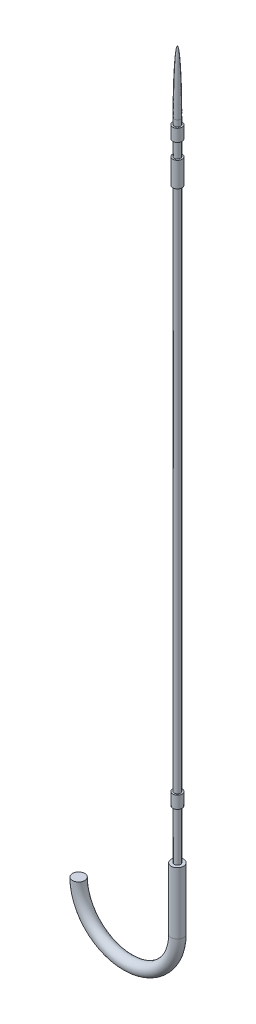
from build123d import *

# Parameters (mm, degrees)
CROQUIS3_R                   = 5
SALIENTE_EXTRUIR1_DEPTH      = 870
CROQUIS5_R                   = 7.5
SALIENTE_EXTRUIR2_DEPTH      = 20
SALIENTE_EXTRUIR3_START      = 80
CROQUIS6_R                   = 5
SALIENTE_EXTRUIR3_DEPTH      = 80
CROQUIS8_R                   = 10
SALIENTE_EXTRUIR4_DEPTH      = 20
SALIENTE_EXTRUIR4_DEPTH_BACK = 20
CROQUIS9_R                   = 7.5
CROQUIS10_R                  = 5
SALIENTE_EXTRUIR5_DEPTH      = 25
SALIENTE_EXTRUIR6_START      = 20
CROQUIS11_R                  = 7.5
SALIENTE_EXTRUIR6_DEPTH      = 20
CROQUIS12_R                  = 5
SALIENTE_EXTRUIR7_DEPTH      = 10
C_PULA2_FACE_RADIUS          = 5
C_PULA2_HEIGHT               = 100


with BuildPart() as part:
    # Croquis3 → Saliente-Extruir1 (new body)
    with BuildSketch(Plane(origin=(0, 0, 0), x_dir=(1, 0, 0), z_dir=(0, 1, 0))):
        Circle(CROQUIS3_R)
    extrude(amount=SALIENTE_EXTRUIR1_DEPTH)

    # Croquis5 → Saliente-Extruir2 (add)
    with BuildSketch(Plane.XZ):
        Circle(CROQUIS5_R)
    extrude(amount=SALIENTE_EXTRUIR2_DEPTH)

    # Croquis6 → Saliente-Extruir3 (add)
    with BuildSketch(Plane.XZ.offset(20).offset(SALIENTE_EXTRUIR3_START)):
        Circle(CROQUIS6_R)
    extrude(amount=-SALIENTE_EXTRUIR3_DEPTH)

    # Barrer1: sweep along a path in Croquis7
    with BuildLine(Plane.XY) as barrer1_path:
        Line((0, -100), (0, -200))
        ThreePointArc((0, -200), (-80, -280), (-160, -200))
    # Croquis8 → Barrer1 (sweep)
    with BuildSketch(Plane.XZ.offset(100)):
        Circle(CROQUIS8_R)
    sweep(path=barrer1_path.line)

    # Croquis9 → Saliente-Extruir4 (add, two sides: drawn at the far end of the back side and taken through both)
    with BuildSketch(Plane(origin=(0, 870, 0), x_dir=(1, 0, 0), z_dir=(0, 1, 0)).offset(-SALIENTE_EXTRUIR4_DEPTH_BACK)):
        Circle(CROQUIS9_R)
    extrude(amount=SALIENTE_EXTRUIR4_DEPTH + SALIENTE_EXTRUIR4_DEPTH_BACK)

    # Croquis10 → Saliente-Extruir5 (add)
    with BuildSketch(Plane(origin=(0, 890, 0), x_dir=(1, 0, 0), z_dir=(0, 1, 0))):
        Circle(CROQUIS10_R)
    extrude(amount=SALIENTE_EXTRUIR5_DEPTH)

    # Croquis11 → Saliente-Extruir6 (add)
    with BuildSketch(Plane(origin=(0, 915, 0), x_dir=(1, 0, 0), z_dir=(0, 1, 0)).offset(SALIENTE_EXTRUIR6_START)):
        Circle(CROQUIS11_R)
    extrude(amount=-SALIENTE_EXTRUIR6_DEPTH)

    # Croquis12 → Saliente-Extruir7 (add)
    with BuildSketch(Plane(origin=(0, 935, 0), x_dir=(1, 0, 0), z_dir=(0, 1, 0))):
        Circle(CROQUIS12_R)
    extrude(amount=SALIENTE_EXTRUIR7_DEPTH)

    # Cúpula2: an elliptical dome of height H over a round flat face of radius A is half a spheroid: the quarter ellipse of half axes A and H revolved about the face's axis
    with BuildSketch(Plane((0, 945, 0), x_dir=(0, 0, -1), z_dir=(1, 0, 0)), mode=Mode.PRIVATE) as c_pula2_quarter:
        Ellipse(C_PULA2_FACE_RADIUS, C_PULA2_HEIGHT)
        Rectangle(C_PULA2_FACE_RADIUS, C_PULA2_HEIGHT, align=(Align.MIN, Align.MIN), mode=Mode.INTERSECT)
    revolve(c_pula2_quarter.sketch, axis=Axis((0, 945, 0), (0, 1, 0)))


solid = part.part
